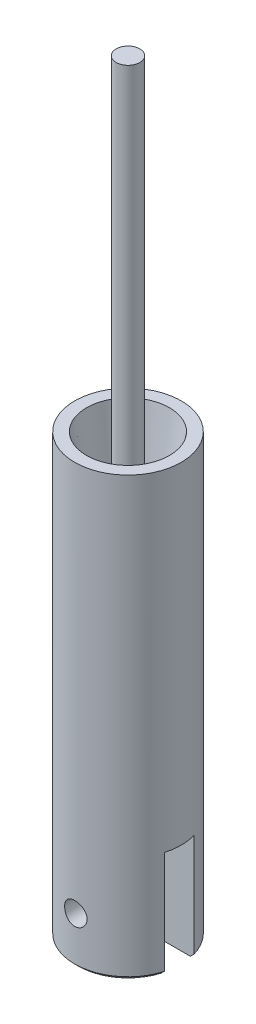
from build123d import *

# Parameters (mm, degrees)
SZKIC1_W                    = 4.5
SZKIC1_H                    = 37
WYTNIJ_WYCI_GNI_CIE1_DEPTH  = 9
DODANIE_WYCI_GNI_CIE1_START = 9
DODANIE_WYCI_GNI_CIE1_DEPTH = 9
SZKIC6_W                    = 1
SZKIC6_H                    = 34
SZKIC7_W                    = 0.95
SZKIC7_H                    = 3.25
OTW_R_1_9_1_9_2_D           = 1.9
SFAZOWANIE1_SIZE            = 0.3


with BuildPart() as part:
    # Szkic1 → Obrót1 (revolve)
    with BuildSketch(Plane(origin=(0, 0, 0), x_dir=(-1, 0, 0), z_dir=(0, 0, -1)), mode=Mode.PRIVATE) as obr_t1_sk:
        with Locations((-2.25, -18.5)):
            Rectangle(SZKIC1_W, SZKIC1_H)
    revolve(obr_t1_sk.sketch.rotate(Axis((0, -37, 0), (0, 1, 0)), 270), axis=Axis((0, -37, 0), (0, 1, 0)))

    # Szkic2 → Wytnij-wyciągnięcie1 (cut)
    with BuildSketch(Plane.XZ.offset(37)):
        with BuildLine():
            Line((-4.322904116, -1.25), (4.322904116, -1.25))
            ThreePointArc((4.322904116, -1.25), (0, 4.5), (-4.322904116, -1.25))
        make_face()
    extrude(amount=-WYTNIJ_WYCI_GNI_CIE1_DEPTH, mode=Mode.SUBTRACT)

    # Szkic3 → Dodanie-wyciągnięcie1 (add)
    with BuildSketch(Plane.XZ.offset(28).offset(DODANIE_WYCI_GNI_CIE1_START)):
        with BuildLine():
            Line((4.322904116, 1.25), (-4.322904116, 1.25))
            ThreePointArc((-4.322904116, 1.25), (0, 4.5), (4.322904116, 1.25))
        make_face()
    extrude(amount=-DODANIE_WYCI_GNI_CIE1_DEPTH)

    # Szkic4 → Otwór1 (revolve, cut)
    with BuildSketch(Plane(origin=(0, 0, 0), x_dir=(0, 0, 1), z_dir=(1, 0, 0))):
        Polygon((0, 0), (0, 6.5), (2.5, 6.5), (3.5, 0), align=None)
    revolve(axis=Axis((0, -110, 0), (0, 1, 0)), mode=Mode.SUBTRACT)

    # Szkic6 → Obrót2 (revolve)
    with BuildSketch(Plane(origin=(0, 0, 0), x_dir=(-1, 0, 0), z_dir=(0, 0, -1)), mode=Mode.PRIVATE) as obr_t2_sk:
        with Locations((-0.5, 10.5)):
            Rectangle(SZKIC6_W, SZKIC6_H)
    revolve(obr_t2_sk.sketch.rotate(Axis((0, -6.5, 0), (0, 1, 0)), 270), axis=Axis((0, -6.5, 0), (0, 1, 0)))

    # Szkic7 → Otwór Ø1.9 (1.9)1 (revolve, cut)
    with BuildSketch(Plane(origin=(0, -33, 1.25), x_dir=(0, 1, 0), z_dir=(1, 0, 0))):
        with Locations((0.475, 1.625)):
            Rectangle(SZKIC7_W, SZKIC7_H)
    revolve(axis=Axis((0, -33, -5.1), (0, 0, 1)), mode=Mode.SUBTRACT)

    # Otwór Ø1.9 (1.9)2 (through all)
    with Locations(Plane.XY.offset(-1.25)):
        with Locations((0, -33)):
            Hole(OTW_R_1_9_1_9_2_D / 2)

    # Sfazowanie1
    sfazowanie1_edges = [part.edges().sort_by_distance(p)[0] for p in [
        (0, -37, 4.5),
        (0, -37, -4.5),
    ]]
    chamfer(sfazowanie1_edges, length=SFAZOWANIE1_SIZE)


solid = part.part
